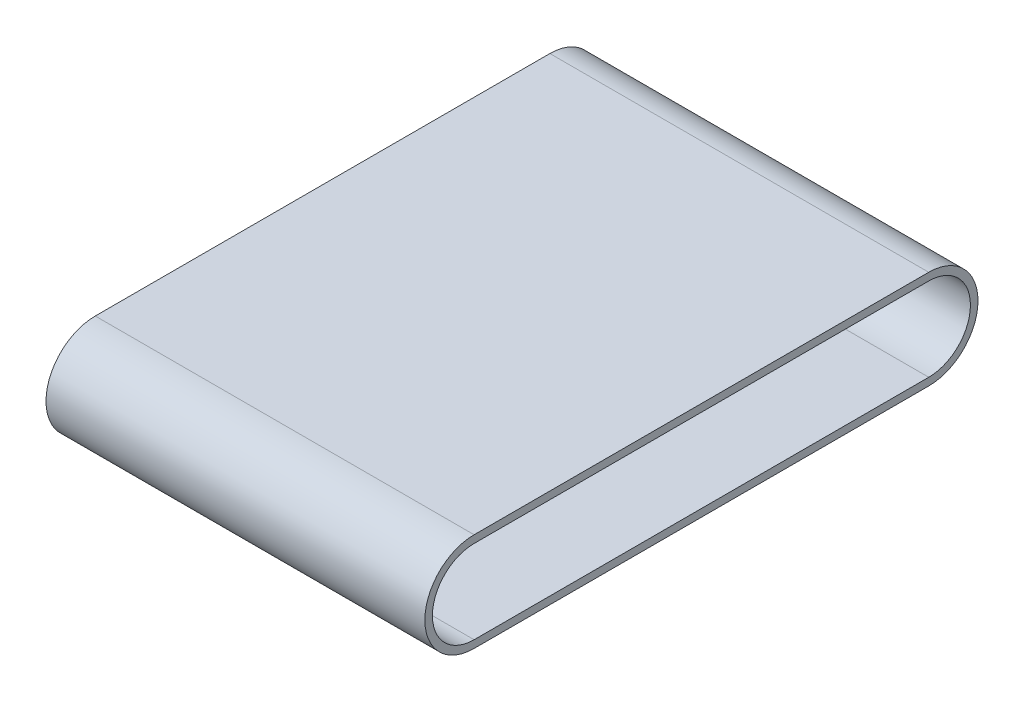
from build123d import *

# Parameters (mm, degrees)
BOSS_EXTRUDE1_DEPTH = 100


with BuildPart() as part:
    # Sketch1 → Boss-Extrude1 (new body)
    with BuildSketch(Plane(origin=(0, 0, 0), x_dir=(0, 0, -1), z_dir=(1, 0, 0))):
        with BuildLine():
            Line((-183.678713125, 35.848101266), (-63.678713125, 35.848101266))
            ThreePointArc((-63.678713125, 35.848101266), (-50.678713125, 22.848101266), (-63.678713125, 9.848101266))
            Line((-63.678713125, 9.848101266), (-183.678713125, 9.848101266))
            ThreePointArc((-183.678713125, 9.848101266), (-196.678713125, 22.848101266), (-183.678713125, 35.848101266))
        make_face()
        with BuildLine():
            Line((-183.678713125, 11.848101266), (-63.678713125, 11.848101266))
            ThreePointArc((-63.678713125, 11.848101266), (-52.678713125, 22.848101266), (-63.678713125, 33.848101266))
            Line((-63.678713125, 33.848101266), (-183.678713125, 33.848101266))
            ThreePointArc((-183.678713125, 33.848101266), (-194.678713125, 22.848101266), (-183.678713125, 11.848101266))
        make_face(mode=Mode.SUBTRACT)
    extrude(amount=BOSS_EXTRUDE1_DEPTH)


solid = part.part
